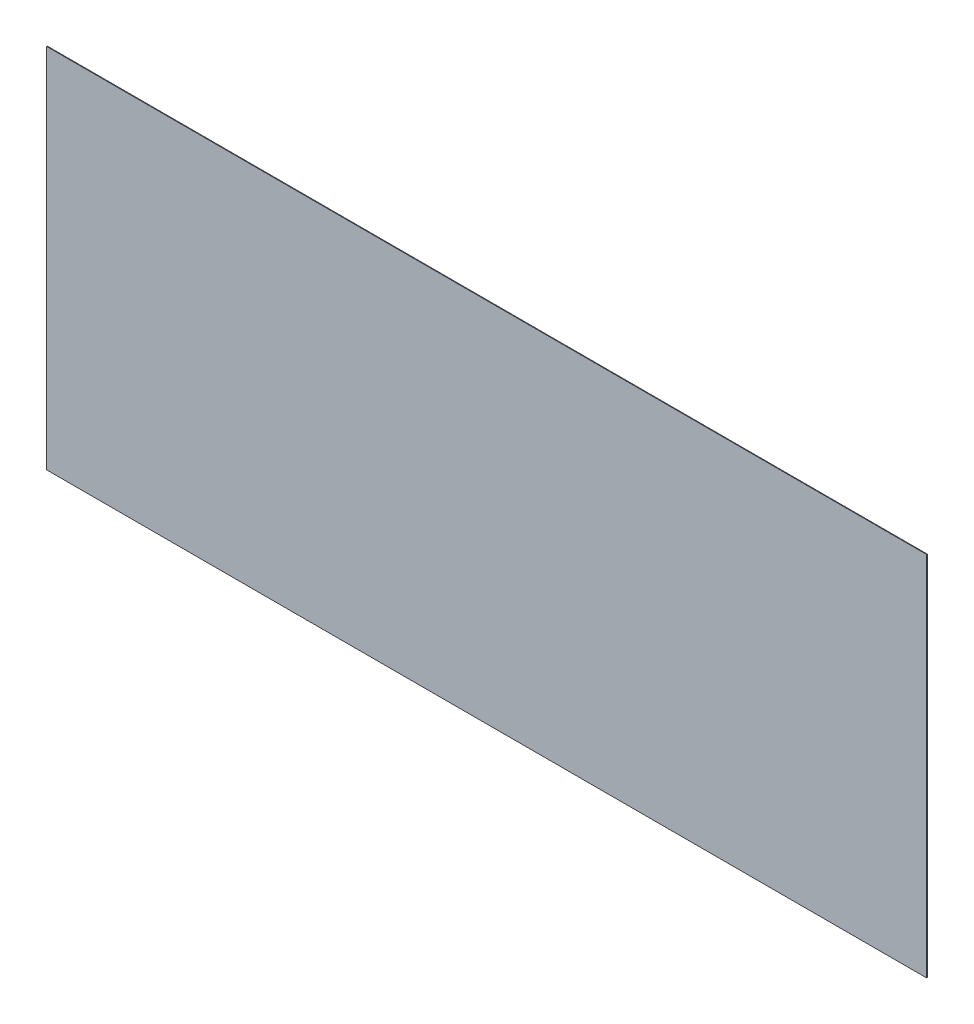
from build123d import *

# Parameters (mm, degrees)
CROQUIS1_W              = 1200
CROQUIS1_H              = 500
SALIENTE_EXTRUIR1_DEPTH = 0.9


with BuildPart() as part:
    # Croquis1 → Saliente-Extruir1 (new body)
    with BuildSketch(Plane.XY):
        with Locations((218.486502559, 81.380753138)):
            Rectangle(CROQUIS1_W, CROQUIS1_H)
    extrude(amount=SALIENTE_EXTRUIR1_DEPTH)


solid = part.part
